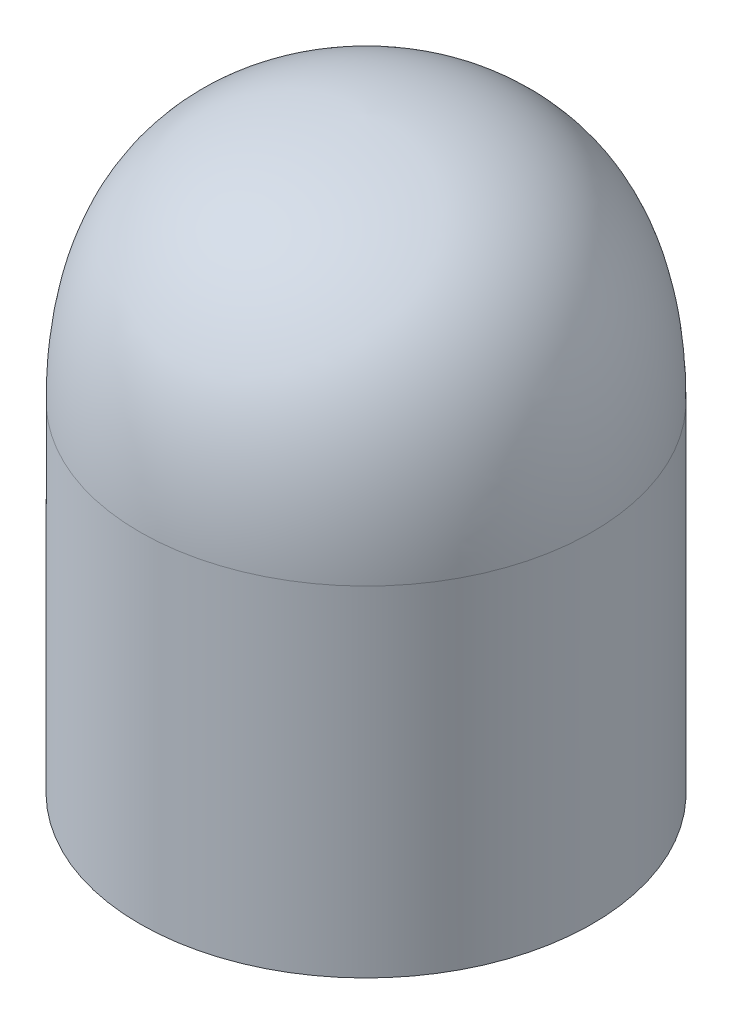
from build123d import *

# Parameters (mm, degrees)
SKETCH_1_R      = 50
SKETCH_1_R_2    = 48
EXTRUDE_1_DEPTH = 75


with BuildPart() as part:
    # 草图1 → 凸台-拉伸1 (new body)
    with BuildSketch(Plane(origin=(0, 0, 0), x_dir=(1, 0, 0), z_dir=(0, 1, 0))):
        with Locations(Location((0, 0, 0), (0, 0, 270))):
            Circle(SKETCH_1_R)
        with Locations(Location((0, 0, 0), (0, 0, 270))):
            Circle(SKETCH_1_R_2, mode=Mode.SUBTRACT)
    extrude(amount=EXTRUDE_1_DEPTH)

    # 草图3 → 旋转1 (revolve)
    with BuildSketch(Plane.XY, mode=Mode.PRIVATE) as revolve_1_sk:
        with BuildLine():
            Line((-50, 75), (-48, 75))
            add(Edge.make_bspline(
                [(-48, 75), (-47.112017253, 108.93768045), (-31.011197494, 127.280282942), (0, 128)],
                knots=[0, 0, 0, 0, 1, 1, 1, 1], degree=3))
            Line((0, 128), (0, 130))
            add(Edge.make_bspline(
                [(-50, 75), (-49.972998102, 112.870317105), (-30.831581261, 129.146665144), (0, 130)],
                knots=[0, 0, 0, 0, 1, 1, 1, 1], degree=3))
        make_face()
    revolve(revolve_1_sk.sketch.rotate(Axis((0, 75, 0), (0, 1, 0)), 270), axis=Axis((0, 75, 0), (0, 1, 0)))


solid = part.part
